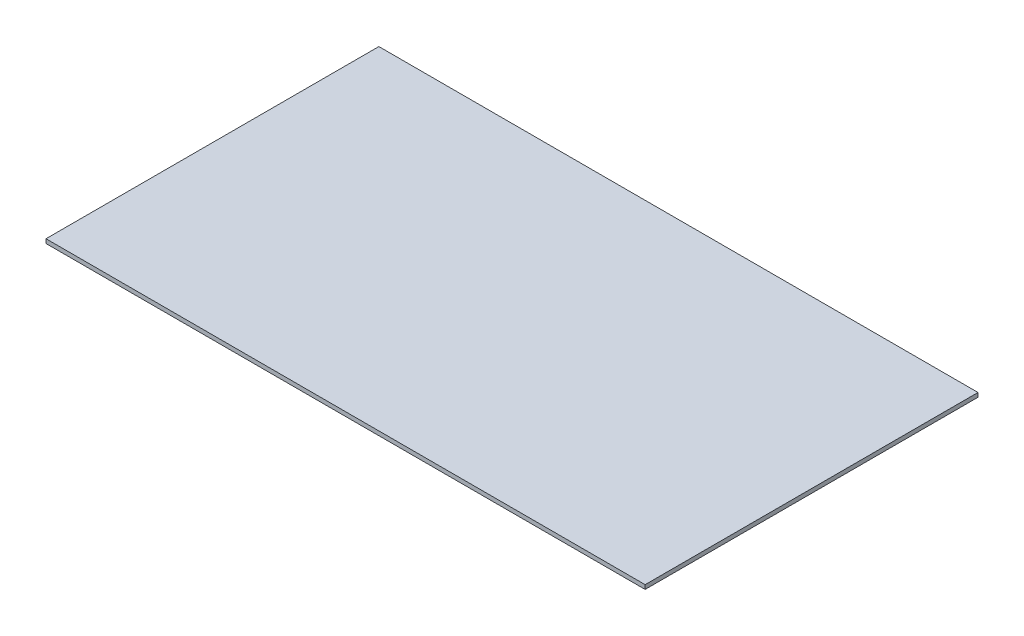
from build123d import *

# Parameters (mm, degrees)
SKETCH1_W           = 914.4
SKETCH1_H           = 508
BOSS_EXTRUDE1_DEPTH = 6.35


with BuildPart() as part:
    # Sketch1 → Boss-Extrude1 (new body)
    with BuildSketch(Plane(origin=(0, 0, 0), x_dir=(1, 0, 0), z_dir=(0, 1, 0))):
        Rectangle(SKETCH1_W, SKETCH1_H)
    extrude(amount=BOSS_EXTRUDE1_DEPTH)


solid = part.part
